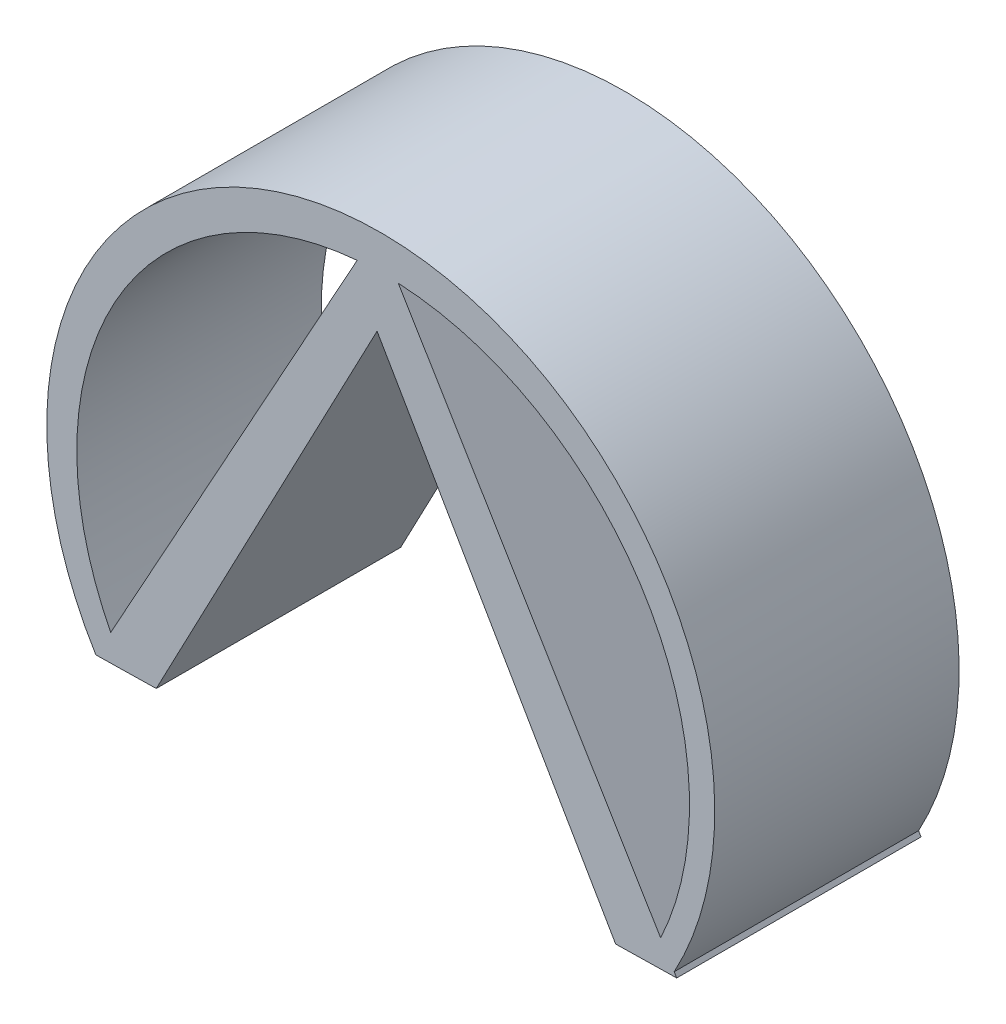
from build123d import *

# Parameters (mm, degrees)
EXTRUDE_1_DEPTH = 50


with BuildPart() as part:
    # 草图3 → 凸台-拉伸1 (new body)
    with BuildSketch(Plane.XY):
        with BuildLine():
            ThreePointArc((-58.793503257, -35.392156003), (-2.246555748, 68.568474272), (59.534802182, -32.36929731))
            Line((59.534802182, -32.36929731), (60.047257822, -33.220589397))
            Line((60.047257822, -33.220589397), (47.551744298, -33.448918799))
            Line((47.551744298, -33.448918799), (-1.253754565, 50.734372928))
            Line((-1.253754565, 50.734372928), (-46.430511789, -35.166248165))
            Line((-46.430511789, -35.166248165), (-58.793503257, -35.392156003))
        make_face()
        with BuildLine():
            Line((-5.324718346, 61.254350615), (-55.742028798, -29.87652016))
            ThreePointArc((-55.742028798, -29.87652016), (-54.854751969, 29.144492628), (-5.324718346, 61.254350615))
        make_face(mode=Mode.SUBTRACT)
        with BuildLine():
            Line((56.759373511, -27.75875099), (3.086082061, 61.403402212))
            ThreePointArc((3.086082061, 61.403402212), (53.687117349, 31.127868506), (56.759373511, -27.75875099))
        make_face(mode=Mode.SUBTRACT)
    extrude(amount=EXTRUDE_1_DEPTH)


solid = part.part
